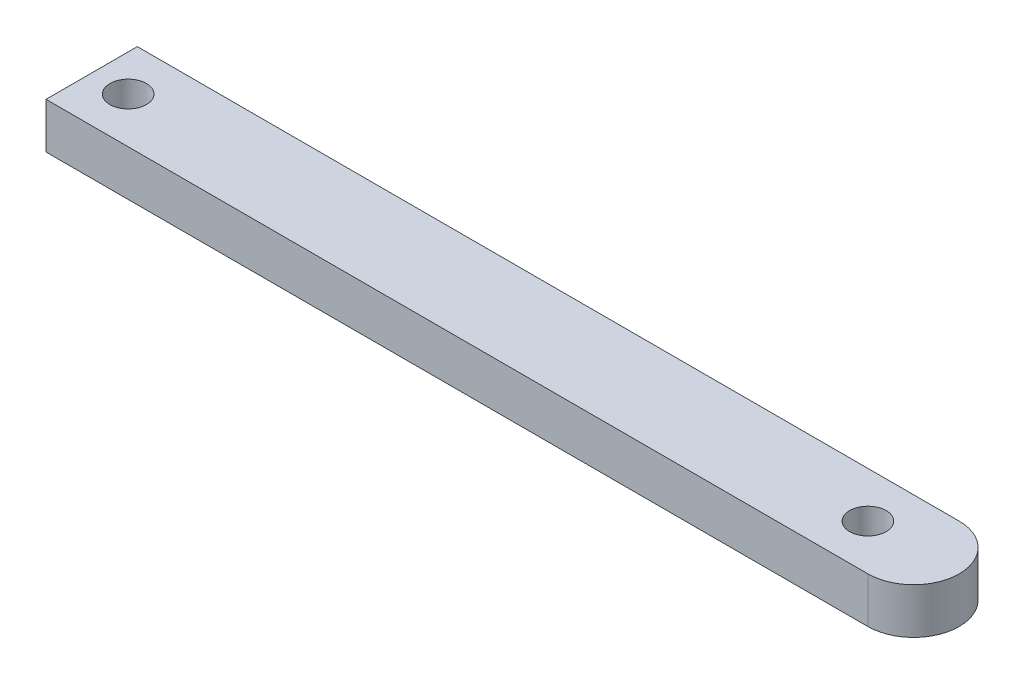
from build123d import *

# Parameters (mm, degrees)
SKETCH1_R           = 2
BOSS_EXTRUDE1_DEPTH = 5


with BuildPart() as part:
    # Sketch1 → Boss-Extrude1 (new body)
    with BuildSketch(Plane(origin=(0, 0, 0), x_dir=(1, 0, 0), z_dir=(0, 1, 0))):
        with BuildLine():
            Line((0, 5), (0, 0))
            Line((0, 0), (90, 0))
            ThreePointArc((90, 0), (95, 5), (90, 10))
            Line((90, 10), (0, 10))
            Line((0, 10), (0, 5))
        make_face()
        with Locations(Location((4, 5, 0), (0, 0, 270))):
            Circle(SKETCH1_R, mode=Mode.SUBTRACT)
        with Locations(Location((85, 5, 0), (0, 0, 270))):
            Circle(SKETCH1_R, mode=Mode.SUBTRACT)
    extrude(amount=BOSS_EXTRUDE1_DEPTH)


solid = part.part
